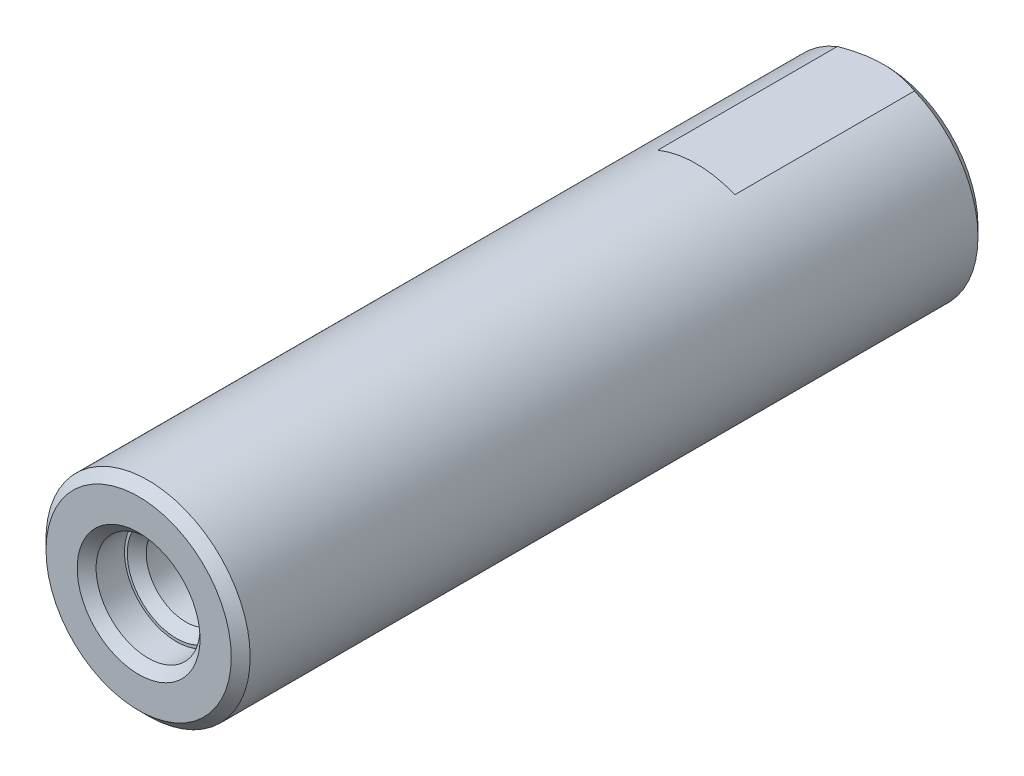
from build123d import *

# Parameters (mm, degrees)
SKETCH_1_R             = 5.4
EXTRUDE_1_DEPTH        = 39.5
HOLE_WIZARD_M5_2_D     = 4.2
HOLE_WIZARD_M5_2_DEPTH = 12.4
HOLE_WIZARD_M5_2_TIP   = 1.2618073
CHAMFER_2_SIZE         = 0.5
SKETCH_9_R             = 2.75
CUT_EXTRUDE_5_DEPTH    = 2
CHAMFER_3_SIZE         = 0.5
CHAMFER_4_SIZE         = 0.5
HOLE_WIZARD_M5_1_D     = 4.2
HOLE_WIZARD_M5_1_DEPTH = 12.4
HOLE_WIZARD_M5_1_TIP   = 1.2618073
CHAMFER_5_SIZE         = 0.5
SKETCH_11_W            = 10
SKETCH_11_H            = 2
CUT_EXTRUDE_6_DEPTH    = 10


with BuildPart() as part:
    # 草图1 → 拉伸1 (new body)
    with BuildSketch(Plane.XY):
        Circle(SKETCH_1_R)
    extrude(amount=EXTRUDE_1_DEPTH)

    # M5 螺纹孔2
    with Locations(Plane.XY.offset(39.5)):
        with Locations((0, 0)):
            Hole(HOLE_WIZARD_M5_2_D / 2, depth=HOLE_WIZARD_M5_2_DEPTH)
            with Locations((0, 0, -(HOLE_WIZARD_M5_2_DEPTH + HOLE_WIZARD_M5_2_TIP / 2))):  # 118° drill point
                Cone(0, HOLE_WIZARD_M5_2_D / 2, HOLE_WIZARD_M5_2_TIP, mode=Mode.SUBTRACT)

    # 倒角2
    chamfer_2_edges = [part.edges().sort_by_distance(p)[0] for p in [
        (-5.4, 0, 39.5),
    ]]
    chamfer(chamfer_2_edges, length=CHAMFER_2_SIZE)

    # 草图9 → 拉伸5 (cut)
    with BuildSketch(Plane.XY.offset(39.5)):
        Circle(SKETCH_9_R)
    extrude(amount=-CUT_EXTRUDE_5_DEPTH, mode=Mode.SUBTRACT)

    # 倒角3
    chamfer_3_edges = [part.edges().sort_by_distance(p)[0] for p in [
        (-2.75, 0, 39.5),
        (2.1, 0, 37.5),
    ]]
    chamfer(chamfer_3_edges, length=CHAMFER_3_SIZE)

    # 倒角4
    chamfer_4_edges = [part.edges().sort_by_distance(p)[0] for p in [
        (-5.4, 0, 0),
    ]]
    chamfer(chamfer_4_edges, length=CHAMFER_4_SIZE)

    # M5 螺纹孔1
    with Locations(Plane(origin=(0, 0, 0), x_dir=(-1, 0, 0), z_dir=(0, 0, -1))):
        with Locations((0, 0)):
            Hole(HOLE_WIZARD_M5_1_D / 2, depth=HOLE_WIZARD_M5_1_DEPTH)
            with Locations((0, 0, -(HOLE_WIZARD_M5_1_DEPTH + HOLE_WIZARD_M5_1_TIP / 2))):  # 118° drill point
                Cone(0, HOLE_WIZARD_M5_1_D / 2, HOLE_WIZARD_M5_1_TIP, mode=Mode.SUBTRACT)

    # 倒角5
    chamfer_5_edges = [part.edges().sort_by_distance(p)[0] for p in [
        (-2.1, 0, 0),
    ]]
    chamfer(chamfer_5_edges, length=CHAMFER_5_SIZE)

    # 草图11 → 拉伸6 (cut)
    with BuildSketch(Plane.XY):
        with Locations((0, 6)):
            Rectangle(SKETCH_11_W, SKETCH_11_H)
    cut_extrude_6 = extrude(amount=CUT_EXTRUDE_6_DEPTH, mode=Mode.SUBTRACT)

    # 镜向1: 拉伸6 across plane
    add(cut_extrude_6.mirror(Plane.ZX), mode=Mode.SUBTRACT)


solid = part.part
